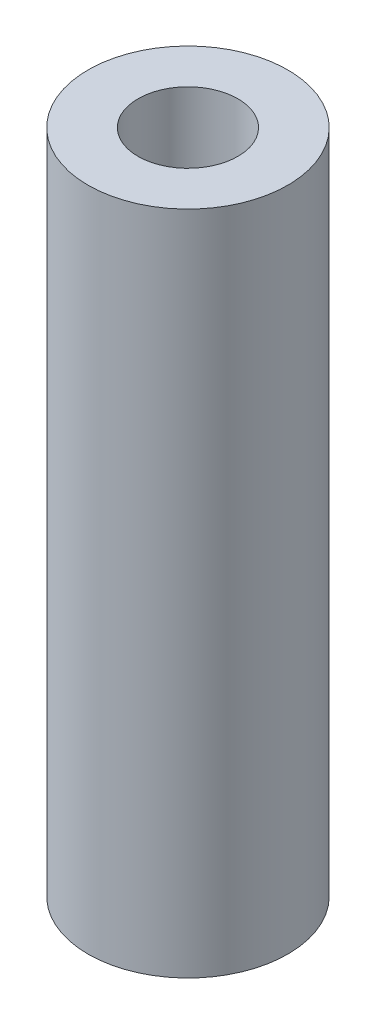
from build123d import *

# Parameters (mm, degrees)
SKETCH_1_R      = 3
SKETCH_1_R_2    = 1.5
EXTRUDE_1_DEPTH = 10


with BuildPart() as part:
    # 草图1 → 凸台-拉伸1 (new, symmetric)
    with BuildSketch(Plane(origin=(0, 0, 0), x_dir=(1, 0, 0), z_dir=(0, 1, 0))):
        with Locations(Location((0, 0, 0), (0, 0, 270))):
            Circle(SKETCH_1_R)
        with Locations(Location((0, 0, 0), (0, 0, 270))):
            Circle(SKETCH_1_R_2, mode=Mode.SUBTRACT)
    extrude(amount=EXTRUDE_1_DEPTH, both=True)


solid = part.part
